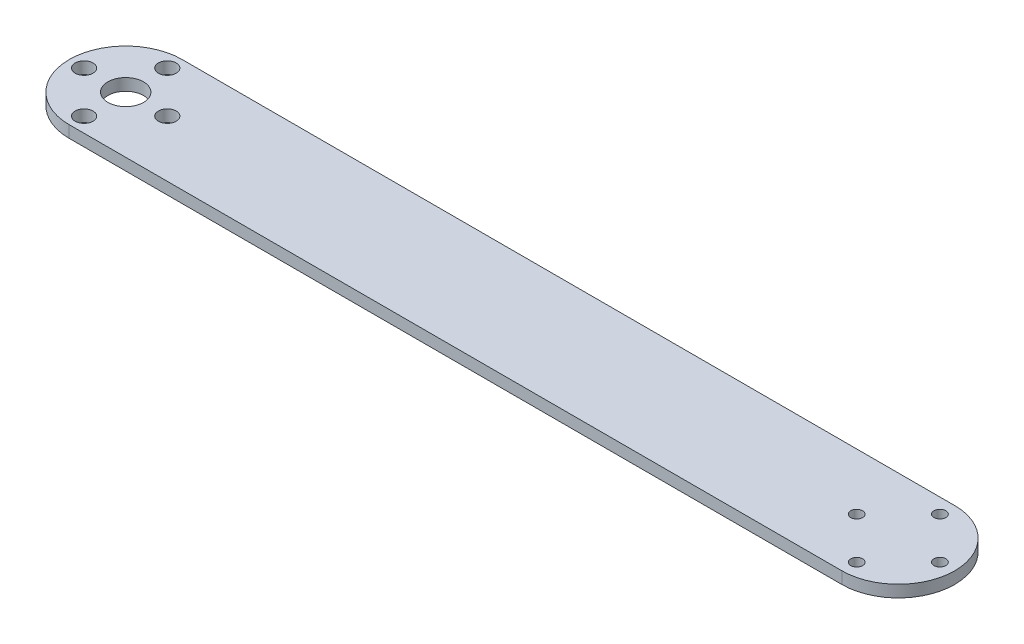
from build123d import *

# Parameters (mm, degrees)
SKETCH_1_R      = 1.5
SKETCH_1_R_2    = 1
SKETCH_1_R_3    = 3
EXTRUDE_1_DEPTH = 2


with BuildPart() as part:
    # Эскиз1 → Бобышка-Вытянуть1 (new body)
    with BuildSketch(Plane(origin=(0, 0, 0), x_dir=(1, 0, 0), z_dir=(0, 1, 0))):
        with BuildLine():
            Line((0, 9.5), (130, 9.5))
            ThreePointArc((130, 9.5), (139.5, 0), (130, -9.5))
            Line((130, -9.5), (0, -9.5))
            ThreePointArc((0, -9.5), (-9.5, 0), (0, 9.5))
        make_face()
        with Locations(Location((0, 7, 0), (0, 0, 270))):
            Circle(SKETCH_1_R, mode=Mode.SUBTRACT)
        with Locations(Location((7, 0, 0), (0, 0, 270))):
            Circle(SKETCH_1_R, mode=Mode.SUBTRACT)
        with Locations(Location((0, -7, 0), (0, 0, 270))):
            Circle(SKETCH_1_R, mode=Mode.SUBTRACT)
        with Locations(Location((-7, 0, 0), (0, 0, 270))):
            Circle(SKETCH_1_R, mode=Mode.SUBTRACT)
        with Locations(Location((130, 7, 0), (0, 0, 270))):
            Circle(SKETCH_1_R_2, mode=Mode.SUBTRACT)
        with Locations(Location((137, 0, 0), (0, 0, 270))):
            Circle(SKETCH_1_R_2, mode=Mode.SUBTRACT)
        with Locations(Location((123, 0, 0), (0, 0, 270))):
            Circle(SKETCH_1_R_2, mode=Mode.SUBTRACT)
        with Locations(Location((130, -7, 0), (0, 0, 270))):
            Circle(SKETCH_1_R_2, mode=Mode.SUBTRACT)
        with Locations(Location((0, 0, 0), (0, 0, 270))):
            Circle(SKETCH_1_R_3, mode=Mode.SUBTRACT)
    extrude(amount=EXTRUDE_1_DEPTH)


solid = part.part
